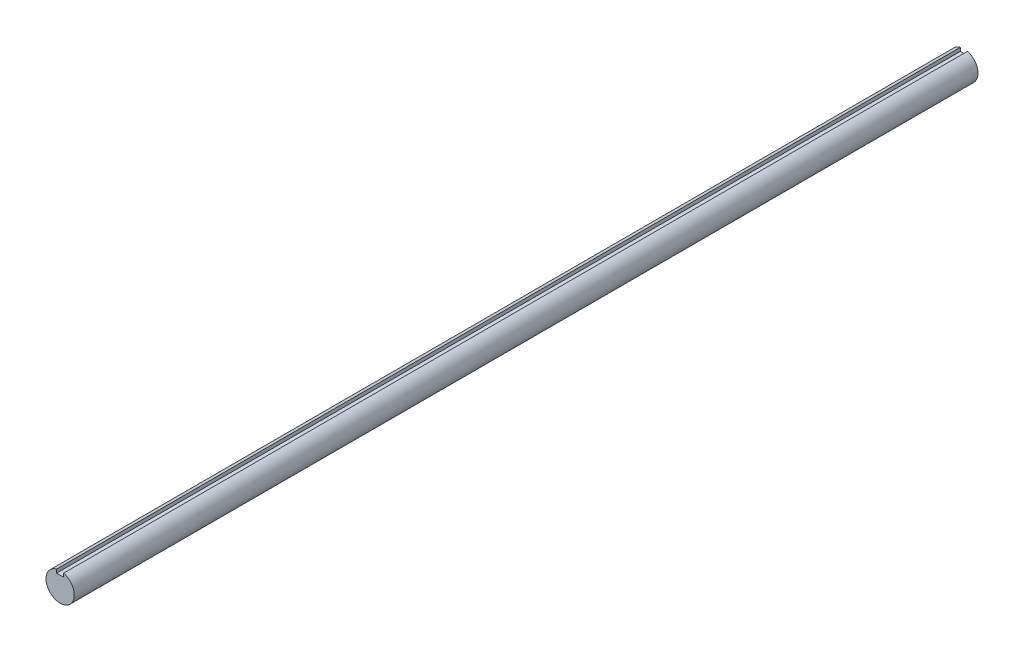
from build123d import *

# Parameters (mm, degrees)
BOSS_EXTRUDE1_DEPTH      = 304.8
BOSS_EXTRUDE1_DEPTH_BACK = 304.8


with BuildPart() as part:
    # Sketch3 → Boss-Extrude1 (new, two sides: drawn at the far end of the back side and taken through both)
    with BuildSketch(Plane.XY.offset(-BOSS_EXTRUDE1_DEPTH_BACK)):
        with BuildLine():
            Line((-2.3876, 6.833299698), (-2.3876, 9.220899698))
            ThreePointArc((-2.3876, 9.220899698), (0, -9.525), (2.3876, 9.220899698))
            Line((2.3876, 9.220899698), (2.3876, 6.833299698))
            Line((2.3876, 6.833299698), (-2.3876, 6.833299698))
        make_face()
    extrude(amount=BOSS_EXTRUDE1_DEPTH + BOSS_EXTRUDE1_DEPTH_BACK)


solid = part.part
